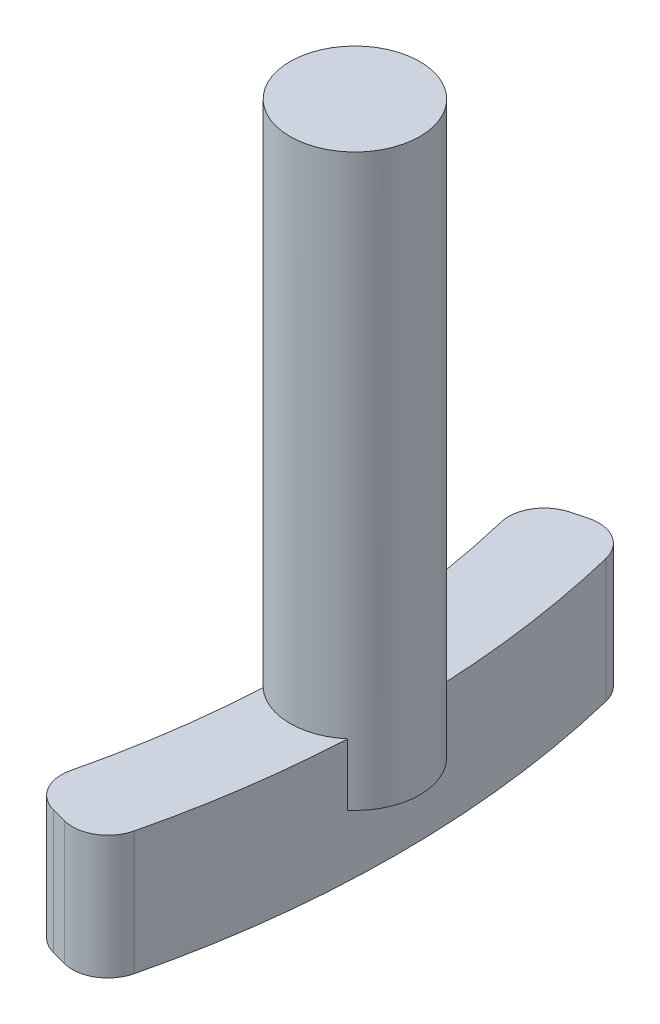
from build123d import *

# Parameters (mm, degrees)
EXTRUDE_1_DEPTH = 4
SKETCH_2_R      = 2.1
EXTRUDE_2_DEPTH = 18.44


with BuildPart() as part:
    # Эскиз1 → Бобышка-Вытянуть1 (new body)
    with BuildSketch(Plane(origin=(0, 0, 0), x_dir=(1, 0, 0), z_dir=(0, 1, 0))):
        with BuildLine():
            Line((-0.978893182, -8.342688368), (-0.495788851, -8.472135783))
            ThreePointArc((-0.495788851, -8.472135783), (0.388763654, -8.35027808), (0.919491196, -7.632217699))
            ThreePointArc((0.919491196, -7.632217699), (1.83125128, 0), (0.919491196, 7.632217699))
            ThreePointArc((0.919491196, 7.632217699), (0.388763654, 8.35027808), (-0.495788851, 8.472135783))
            Line((-0.495788851, 8.472135783), (-0.978893182, 8.342688368))
            ThreePointArc((-0.978893182, 8.342688368), (-1.670093706, 7.818977284), (-1.798995086, 6.961413352))
            ThreePointArc((-1.798995086, 6.961413352), (-0.96874872, 0), (-1.798995086, -6.961413352))
            ThreePointArc((-1.798995086, -6.961413352), (-1.670093706, -7.818977284), (-0.978893182, -8.342688368))
        make_face()
    extrude(amount=EXTRUDE_1_DEPTH)

    # Эскиз2 → Бобышка-Вытянуть2 (add)
    with BuildSketch(Plane(origin=(0, 2, 0), x_dir=(1, 0, 0), z_dir=(0, 1, 0))):
        with Locations(Location((0.43125128, 0, 0), (0, 0, 49.620343895))):
            Circle(SKETCH_2_R)
    extrude(amount=EXTRUDE_2_DEPTH)


solid = part.part
